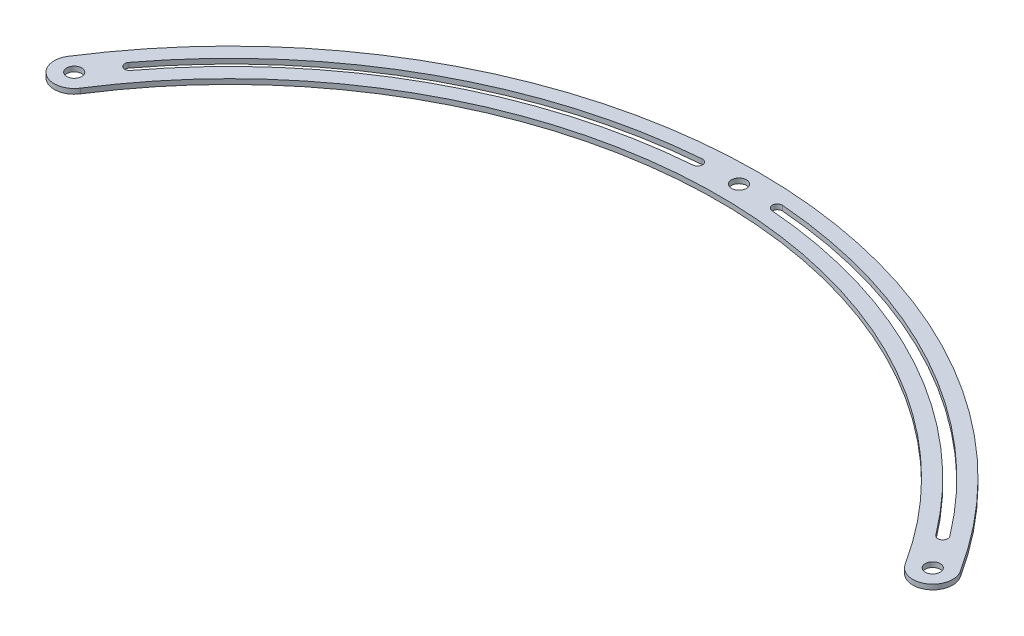
from build123d import *

# Parameters (mm, degrees)
SKETCH_1_R      = 1.5
EXTRUDE_1_DEPTH = 1


with BuildPart() as part:
    # 草图1 → 凸台-拉伸1 (new body)
    with BuildSketch(Plane(origin=(0, 0, 0), x_dir=(1, 0, 0), z_dir=(0, 1, 0))):
        with BuildLine():
            ThreePointArc((89.399493256, 56.953758485), (0, 106), (-89.399493256, 56.953758485))
            ThreePointArc((-89.399493256, 56.953758485), (-88.175125906, 51.430994268), (-82.65236169, 52.655361618))
            ThreePointArc((-82.65236169, 52.655361618), (0, 98), (82.65236169, 52.655361618))
            ThreePointArc((82.65236169, 52.655361618), (88.175125906, 51.430994268), (89.399493256, 56.953758485))
        make_face()
        with Locations(Location((0, 102, 0), (0, 0, 270))):
            Circle(SKETCH_1_R, mode=Mode.SUBTRACT)
        with Locations(Location((-86.025927473, 54.804560051, 0), (0, 0, 270))):
            Circle(SKETCH_1_R, mode=Mode.SUBTRACT)
        with Locations(Location((86.025927473, 54.804560051, 0), (0, 0, 270))):
            Circle(SKETCH_1_R, mode=Mode.SUBTRACT)
        with BuildLine():
            ThreePointArc((-8.078431373, 102.682710066), (-49.544575655, 90.301356707), (-82.264932334, 61.979681413))
            ThreePointArc((-82.264932334, 61.979681413), (-82.067988151, 60.579248269), (-80.667555008, 60.776192453))
            ThreePointArc((-80.667555008, 60.776192453), (-48.58254506, 88.547932305), (-7.921568627, 100.688871036))
            ThreePointArc((-7.921568627, 100.688871036), (-7.003080485, 101.764221924), (-8.078431373, 102.682710066))
        make_face(mode=Mode.SUBTRACT)
        with BuildLine():
            ThreePointArc((82.264932334, 61.979681413), (49.544575655, 90.301356707), (8.078431373, 102.682710066))
            ThreePointArc((8.078431373, 102.682710066), (7.003080485, 101.764221924), (7.921568627, 100.688871036))
            ThreePointArc((7.921568627, 100.688871036), (48.58254506, 88.547932305), (80.667555008, 60.776192453))
            ThreePointArc((80.667555008, 60.776192453), (82.067988151, 60.579248269), (82.264932334, 61.979681413))
        make_face(mode=Mode.SUBTRACT)
    extrude(amount=EXTRUDE_1_DEPTH)


solid = part.part
